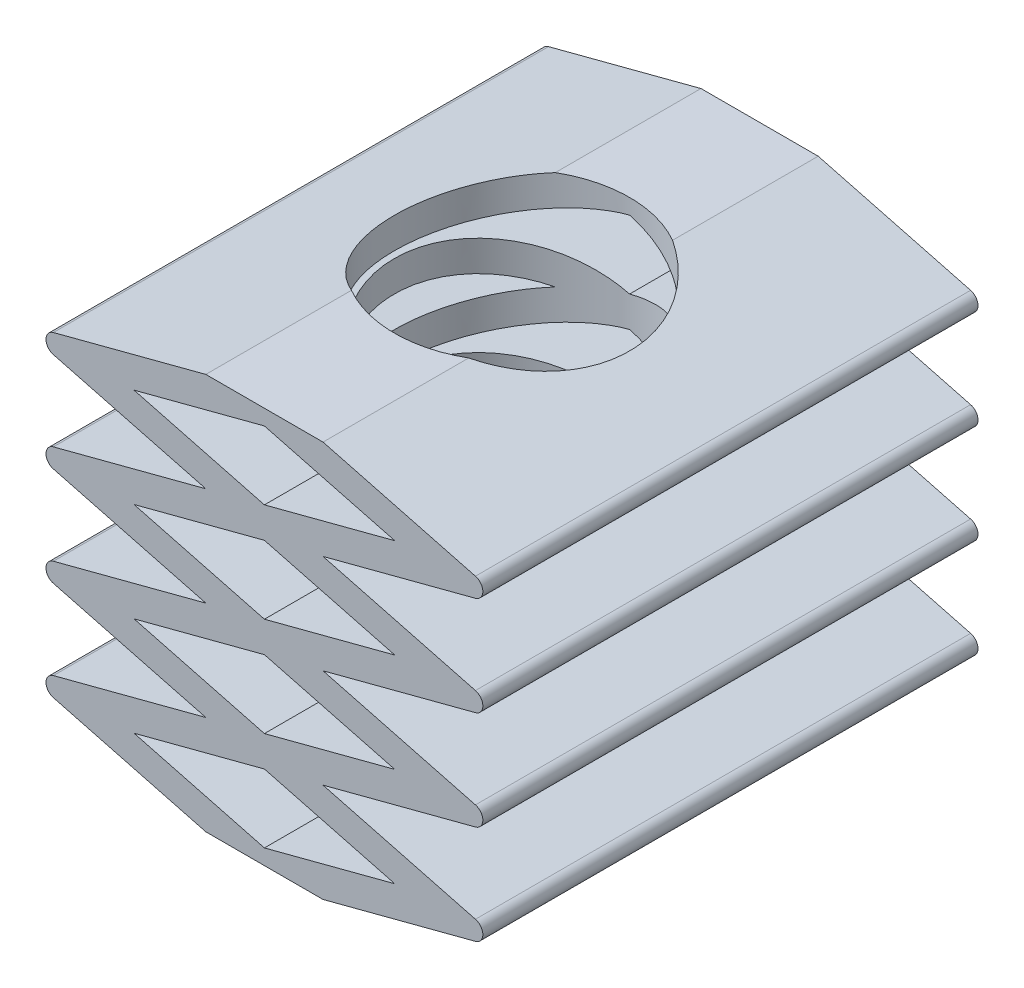
from build123d import *

# Parameters (mm, degrees)
BOSS_EXTRUDE3_DEPTH = 10
LPATTERN1_COUNT     = 4
LPATTERN1_PITCH     = 2
SKETCH3_R           = 2.375
CUT_EXTRUDE1_DEPTH  = 14.747727085
FILLET1_R           = 0.2


with BuildPart() as part:
    # Sketch2 → Boss-Extrude3 (new body)
    with BuildSketch(Plane.XY):
        Polygon((-5, 1), (-1.183578012, 0), (0, 0.310127658), (-2.632843976, 1), (0, 1.689872342), (-1.183578012, 2), align=None)
        Polygon((0, 0.310127658), (1.183578012, 0), (5, 1), (1.183578012, 2), (0, 1.689872342), (2.632843976, 1), align=None)
        Polygon((1.183578012, 2), (-1.183578012, 2), (0, 1.689872342), align=None)
        Polygon((0, 0.310127658), (-1.183578012, 0), (1.183578012, 0), align=None)
    boss_extrude3 = extrude(amount=BOSS_EXTRUDE3_DEPTH)

    # LPattern1: Boss-Extrude3 ×4
    with Locations(*[(0, i * LPATTERN1_PITCH, 0) for i in range(1, LPATTERN1_COUNT)]):
        add(boss_extrude3)

    # Sketch3 → Cut-Extrude1 (cut, through all)
    with BuildSketch(Plane.XZ):
        with Locations(Location((0, 5, 0), (0, 0, 270))):
            Circle(SKETCH3_R)
    extrude(amount=-CUT_EXTRUDE1_DEPTH, mode=Mode.SUBTRACT)

    # Fillet1
    fillet1_edges = [part.edges().sort_by_distance(p)[0] for p in [
        (5, 1, 5),
        (-5, 1, 5),
        (5, 3, 5),
        (-5, 3, 5),
        (5, 5, 5),
        (-5, 5, 5),
        (5, 7, 5),
        (-5, 7, 5),
    ]]
    fillet(fillet1_edges, radius=FILLET1_R)


solid = part.part
